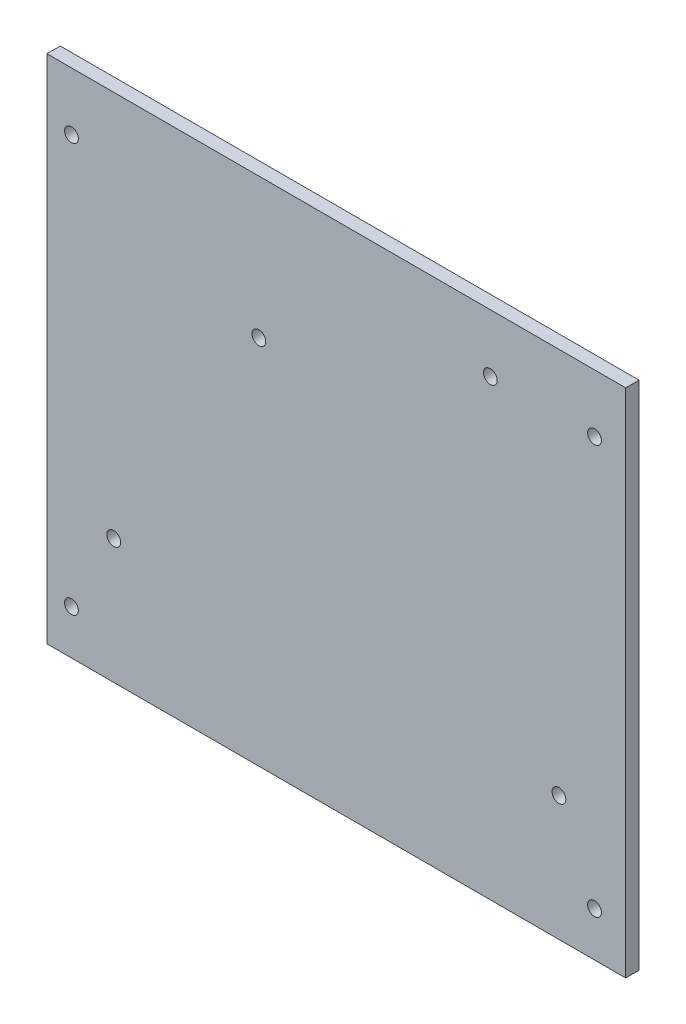
from build123d import *

# Parameters (mm, degrees)
SKETCH1_W           = 130
SKETCH1_H           = 114.8
SKETCH1_R           = 1.55
BOSS_EXTRUDE1_DEPTH = 3
CUT_EXTRUDE1_REACH  = 88.768
SKETCH3_R           = 1.55
CUT_EXTRUDE2_REACH  = 88.768
SKETCH4_R           = 1.55


with BuildPart() as part:
    # Sketch1 → Boss-Extrude1 (new body)
    with BuildSketch(Plane.XY):
        Rectangle(SKETCH1_W, SKETCH1_H)
        with Locations((-59.5, 44.4)):
            Circle(SKETCH1_R, mode=Mode.SUBTRACT)
        with Locations((58, 44.4)):
            Circle(SKETCH1_R, mode=Mode.SUBTRACT)
        with Locations((58, -47.4)):
            Circle(SKETCH1_R, mode=Mode.SUBTRACT)
        with Locations((-59.5, -47.4)):
            Circle(SKETCH1_R, mode=Mode.SUBTRACT)
    extrude(amount=BOSS_EXTRUDE1_DEPTH)

    # Sketch3 → Cut-Extrude1 (cut, up to next)
    with BuildSketch(Plane(origin=(0, 0, 0), x_dir=(-1, 0, 0), z_dir=(0, 0, -1)), mode=Mode.PRIVATE) as cut_extrude1_sk1:
        with Locations((-50, -29.4)):
            Circle(SKETCH3_R)
    cut_extrude1_tool1 = extrude(cut_extrude1_sk1.sketch, amount=-CUT_EXTRUDE1_REACH, mode=Mode.PRIVATE) & part.part
    # Sketch3 → Cut-Extrude1 (cut, up to next)
    with BuildSketch(Plane(origin=(0, 0, 0), x_dir=(-1, 0, 0), z_dir=(0, 0, -1)), mode=Mode.PRIVATE) as cut_extrude1_sk2:
        with Locations((50, -29.4)):
            Circle(SKETCH3_R)
    cut_extrude1_tool2 = extrude(cut_extrude1_sk2.sketch, amount=-CUT_EXTRUDE1_REACH, mode=Mode.PRIVATE) & part.part
    add(cut_extrude1_tool1.solids().sort_by_distance((50, -29.4, 0))[0], mode=Mode.SUBTRACT)
    add(cut_extrude1_tool2.solids().sort_by_distance((-50, -29.4, 0))[0], mode=Mode.SUBTRACT)

    # Sketch4 → Cut-Extrude2 (cut, up to next)
    with BuildSketch(Plane(origin=(0, 0, 0), x_dir=(-1, 0, 0), z_dir=(0, 0, -1)), mode=Mode.PRIVATE) as cut_extrude2_sk1:
        with Locations((-34.6, 44.4)):
            Circle(SKETCH4_R)
    cut_extrude2_tool1 = extrude(cut_extrude2_sk1.sketch, amount=-CUT_EXTRUDE2_REACH, mode=Mode.PRIVATE) & part.part
    # Sketch4 → Cut-Extrude2 (cut, up to next)
    with BuildSketch(Plane(origin=(0, 0, 0), x_dir=(-1, 0, 0), z_dir=(0, 0, -1)), mode=Mode.PRIVATE) as cut_extrude2_sk2:
        with Locations((17.4, 25.96)):
            Circle(SKETCH4_R)
    cut_extrude2_tool2 = extrude(cut_extrude2_sk2.sketch, amount=-CUT_EXTRUDE2_REACH, mode=Mode.PRIVATE) & part.part
    add(cut_extrude2_tool1.solids().sort_by_distance((34.6, 44.4, 0))[0], mode=Mode.SUBTRACT)
    add(cut_extrude2_tool2.solids().sort_by_distance((-17.4, 25.96, 0))[0], mode=Mode.SUBTRACT)


solid = part.part
